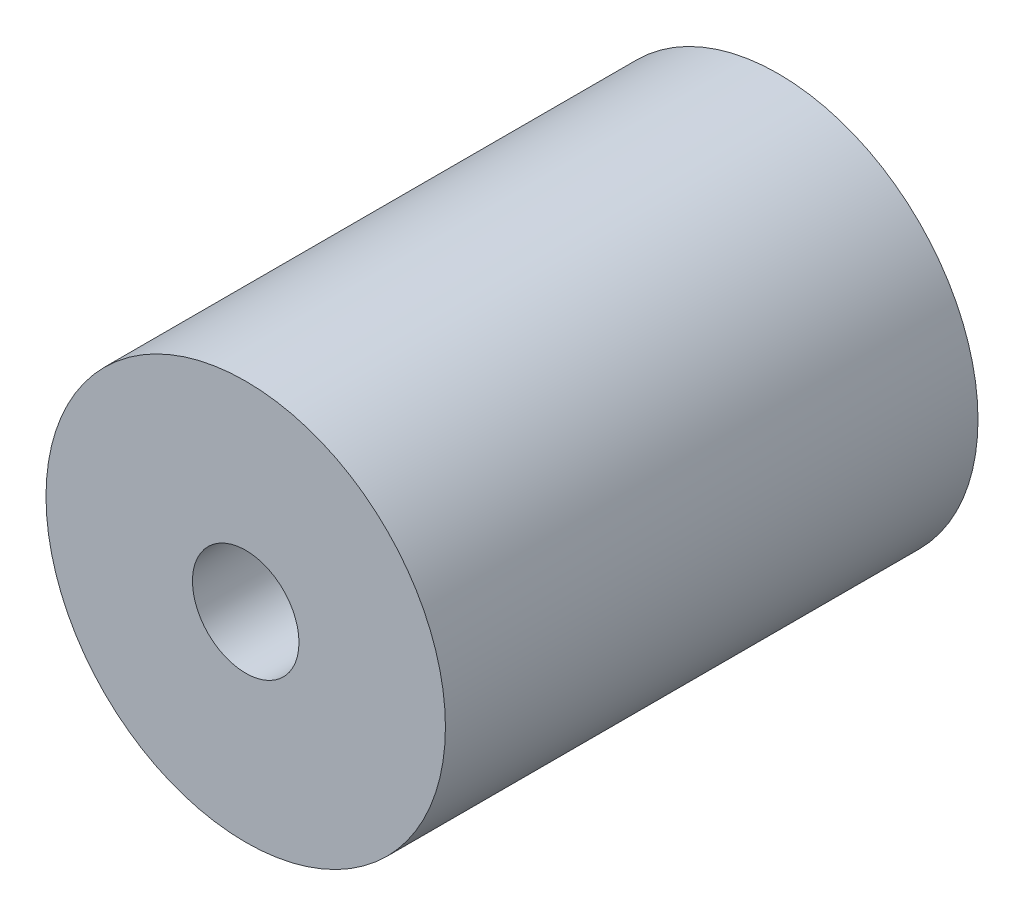
from build123d import *

# Parameters (mm, degrees)
ESQUISSE1_R             = 15
BOSS_EXTRU_1_DEPTH      = 40
ESQUISSE2_R             = 4
ENL_V_MAT_EXTRU_1_DEPTH = 15
ESQUISSE3_R             = 6.35
ENL_V_MAT_EXTRU_2_DEPTH = 15


with BuildPart() as part:
    # Esquisse1 → Boss.-Extru.1 (new body)
    with BuildSketch(Plane.XY):
        Circle(ESQUISSE1_R)
    extrude(amount=BOSS_EXTRU_1_DEPTH)

    # Esquisse2 → Enlèv. mat.-Extru.1 (cut)
    with BuildSketch(Plane.XY.offset(40)):
        Circle(ESQUISSE2_R)
    extrude(amount=-ENL_V_MAT_EXTRU_1_DEPTH, mode=Mode.SUBTRACT)

    # Esquisse3 → Enlèv. mat.-Extru.2 (cut)
    with BuildSketch(Plane(origin=(0, 0, 0), x_dir=(-1, 0, 0), z_dir=(0, 0, -1))):
        Circle(ESQUISSE3_R)
    extrude(amount=-ENL_V_MAT_EXTRU_2_DEPTH, mode=Mode.SUBTRACT)


solid = part.part
